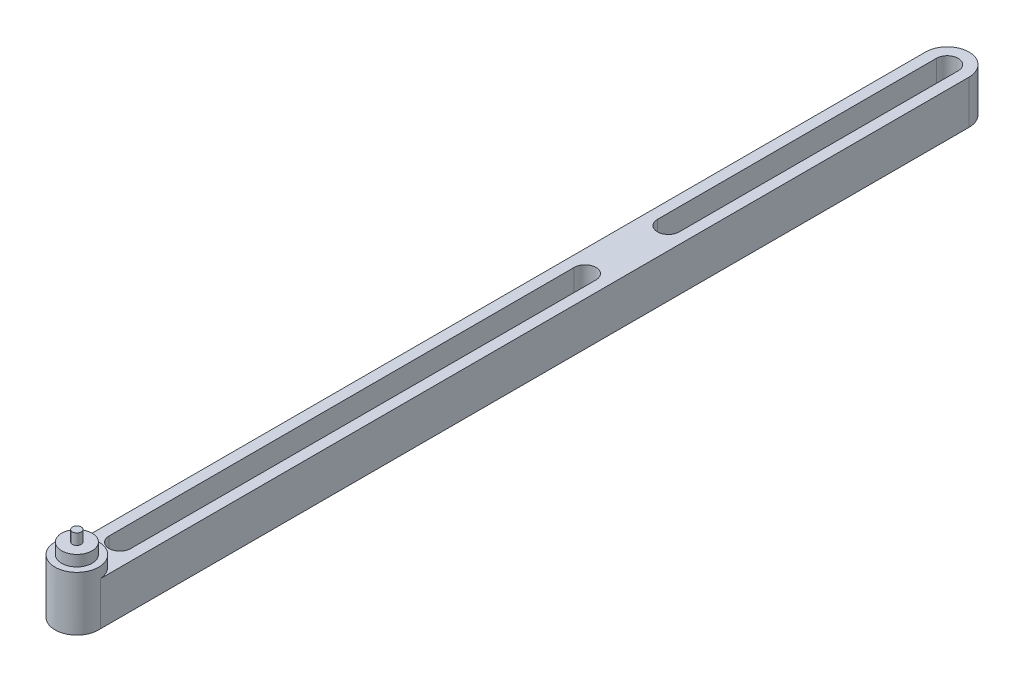
from build123d import *

# Parameters (mm, degrees)
BOSS_EXTRUDE7_DEPTH  = 10
BOSS_EXTRUDE8_DEPTH  = 12.5
SKETCH2_R            = 3.5
BOSS_EXTRUDE9_DEPTH  = 2.5
SKETCH3_R            = 1
BOSS_EXTRUDE10_DEPTH = 2.5


with BuildPart() as part:
    # Sketch1 → Boss-Extrude7 (new body)
    with BuildSketch(Plane(origin=(0, 0, 0), x_dir=(1, 0, 0), z_dir=(0, 1, 0))):
        with BuildLine():
            Line((-5, 46.203703704), (-5, -153.415497967))
            ThreePointArc((-5, -153.415497967), (0, -148.781816526), (5, -153.415497967))
            Line((5, -153.415497967), (5, 46.203703704))
            ThreePointArc((5, 46.203703704), (0, 51.203703704), (-5, 46.203703704))
        make_face()
        with BuildLine():
            ThreePointArc((-2.5, -37.014405443), (0, -34.514405443), (2.5, -37.014405443))
            Line((2.5, -37.014405443), (2.5, -143.90389726))
            ThreePointArc((2.5, -143.90389726), (0, -146.40389726), (-2.5, -143.90389726))
            Line((-2.5, -143.90389726), (-2.5, -37.014405443))
        make_face(mode=Mode.SUBTRACT)
        with BuildLine():
            ThreePointArc((-2.5, 46.203703704), (0, 48.703703704), (2.5, 46.203703704))
            Line((2.5, 46.203703704), (2.5, -17.887410681))
            ThreePointArc((2.5, -17.887410681), (0, -20.387410681), (-2.5, -17.887410681))
            Line((-2.5, -17.887410681), (-2.5, 46.203703704))
        make_face(mode=Mode.SUBTRACT)
    extrude(amount=BOSS_EXTRUDE7_DEPTH)

    # Sketch1<11> → Boss-Extrude8 (add)
    with BuildSketch(Plane(origin=(0, 0, 0), x_dir=(1, 0, 0), z_dir=(0, 1, 0))):
        with BuildLine():
            ThreePointArc((5, -153.415497967), (0, -148.781816526), (-5, -153.415497967))
            ThreePointArc((-5, -153.415497967), (-0.190536762, -158.807154817), (5.01447977, -153.796296296))
            ThreePointArc((5.01447977, -153.796296296), (5.01085852, -153.605759534), (5, -153.415497967))
        make_face()
    extrude(amount=BOSS_EXTRUDE8_DEPTH)

    # Sketch2 → Boss-Extrude9 (add)
    with BuildSketch(Plane(origin=(0, 12.5, 0), x_dir=(1, 0, 0), z_dir=(0, 1, 0))):
        with Locations((0, -153.796296296)):
            Circle(SKETCH2_R)
    extrude(amount=BOSS_EXTRUDE9_DEPTH)

    # Sketch3 → Boss-Extrude10 (add)
    with BuildSketch(Plane(origin=(0, 15, 0), x_dir=(1, 0, 0), z_dir=(0, 1, 0))):
        with Locations((0, -153.796296296)):
            Circle(SKETCH3_R)
    extrude(amount=BOSS_EXTRUDE10_DEPTH)


solid = part.part
